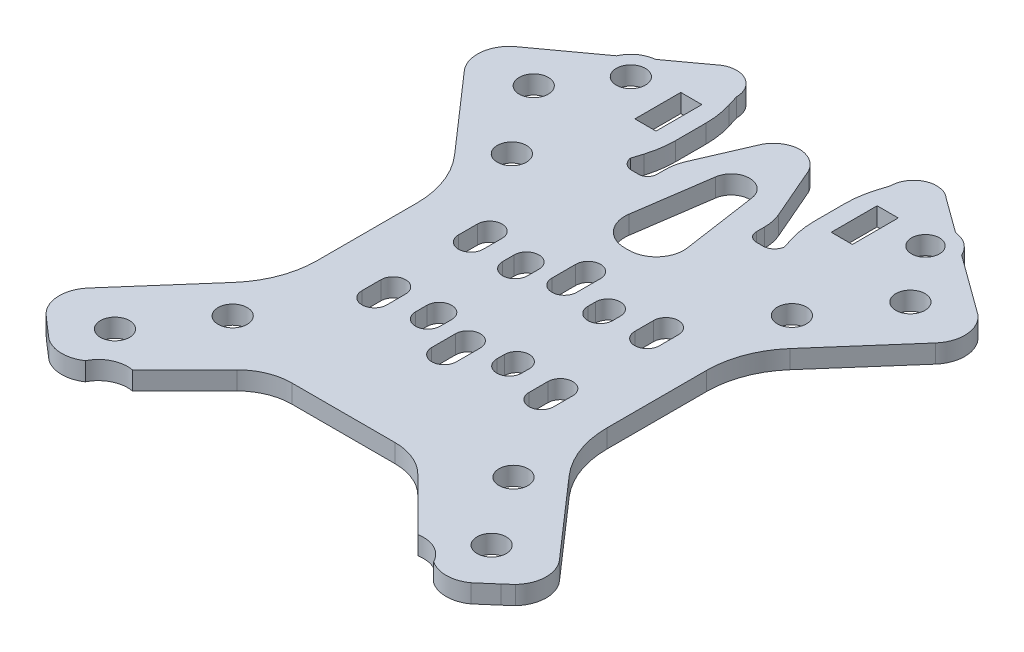
from build123d import *

# Parameters (mm, degrees)
CROQUIS2_R              = 1.59
CROQUIS2_R_2            = 1.5875
CROQUIS2_R_3            = 1.590000003
CROQUIS2_R_4            = 1.52
CROQUIS2_W              = 2.3
CROQUIS2_H              = 5
SALIENTE_EXTRUIR1_DEPTH = 2


with BuildPart() as part:
    # Croquis2 → Saliente-Extruir1 (new body)
    with BuildSketch(Plane(origin=(0, 0, 0), x_dir=(1, 0, 0), z_dir=(0, 1, 0))):
        with BuildLine():
            Line((-18.25536195, -12.016111847), (-25.654088229, -20.470893156))
            ThreePointArc((-25.654088229, -20.470893156), (-26.519678095, -22.835784768), (-25.57354606, -25.169621165))
            Line((-25.57354606, -25.169621165), (-24.742372568, -25.914075676))
            Line((-24.742372568, -25.914075676), (-22.972153409, -27.446083615))
            ThreePointArc((-22.972153409, -27.446083615), (-20.975135837, -28.097582379), (-18.96479715, -27.488428717))
            ThreePointArc((-18.96479715, -27.488428717), (-17.537304596, -26.067045976), (-15.541615973, -25.792654271))
            Line((-15.541615973, -25.792654271), (-9.856067815, -20.097418653))
            ThreePointArc((-9.856067815, -20.097418653), (-7.911909666, -18.801779306), (-5.620288821, -18.346909954))
            Line((-5.620288821, -18.346909954), (5.620288821, -18.346909954))
            ThreePointArc((5.620288821, -18.346909954), (7.911909666, -18.801779306), (9.856067815, -20.097418653))
            Line((9.856067815, -20.097418653), (15.541615973, -25.792654271))
            ThreePointArc((15.541615973, -25.792654271), (17.537304596, -26.067045976), (18.96479715, -27.488428717))
            ThreePointArc((18.96479715, -27.488428717), (20.975135837, -28.097582379), (22.972153409, -27.446083615))
            Line((22.972153409, -27.446083615), (24.742372568, -25.914075676))
            Line((24.742372568, -25.914075676), (25.57354606, -25.169621165))
            ThreePointArc((25.57354606, -25.169621165), (26.519678095, -22.835784768), (25.654088229, -20.470893156))
            Line((25.654088229, -20.470893156), (18.25536195, -12.016111847))
            ThreePointArc((18.25536195, -12.016111847), (16.419845193, -8.948181441), (15.780779256, -5.4306662))
            Line((15.780779256, -5.4306662), (15.780779256, 5.4306662))
            ThreePointArc((15.780779256, 5.4306662), (16.419845193, 8.948181441), (18.25536195, 12.016111847))
            Line((18.25536195, 12.016111847), (25.654088229, 20.470893156))
            ThreePointArc((25.654088229, 20.470893156), (26.530308227, 23.005689388), (25.355142951, 25.416485937))
            Line((25.355142951, 25.416485937), (18.78888202, 30.200247321))
            ThreePointArc((18.78888202, 30.200247321), (17.806953387, 31.422484528), (16.34255947, 31.982482822))
            Line((16.34255947, 31.982482822), (12.561458087, 34.737153551))
            ThreePointArc((12.561458087, 34.737153551), (9.874030074, 35.155779391), (8.394864944, 32.873327323))
            Line((8.394864944, 32.873327323), (8.021421807, 31.657286053))
            ThreePointArc((8.021421807, 31.657286053), (7.691575606, 30.205895283), (7.580808922, 28.721622928))
            Line((7.580808922, 28.721622928), (7.580808922, 25.398403441))
            ThreePointArc((7.580808922, 25.398403441), (7.695379905, 23.889001856), (8.036467551, 22.414186995))
            Line((8.036467551, 22.414186995), (8.38479276, 21.300147594))
            ThreePointArc((8.38479276, 21.300147594), (7.968360691, 20.527060023), (7.14619906, 20.218627998))
            Line((7.14619906, 20.218627998), (6.412176591, 20.218627998))
            ThreePointArc((6.412176591, 20.218627998), (5.70506981, 20.511521217), (5.412176591, 21.218627998))
            Line((5.412176591, 21.218627998), (5.412176591, 22.079422133))
            ThreePointArc((5.412176591, 22.079422133), (5.308230514, 23.093648922), (5.000714199, 24.065705754))
            Line((5.000714199, 24.065705754), (2.518171143, 29.800658234))
            ThreePointArc((2.518171143, 29.800658234), (1.464464231, 30.91120601), (0, 31.357254366))
            ThreePointArc((0, 31.357254366), (-1.464464231, 30.91120601), (-2.518171143, 29.800658234))
            Line((-2.518171143, 29.800658234), (-5.000714199, 24.065705754))
            ThreePointArc((-5.000714199, 24.065705754), (-5.308230514, 23.093648922), (-5.412176591, 22.079422133))
            Line((-5.412176591, 22.079422133), (-5.412176591, 21.218627998))
            ThreePointArc((-5.412176591, 21.218627998), (-5.70506981, 20.511521217), (-6.412176591, 20.218627998))
            Line((-6.412176591, 20.218627998), (-7.14619906, 20.218627998))
            ThreePointArc((-7.14619906, 20.218627998), (-7.968360691, 20.527060023), (-8.38479276, 21.300147594))
            Line((-8.38479276, 21.300147594), (-8.036467551, 22.414186995))
            ThreePointArc((-8.036467551, 22.414186995), (-7.695379905, 23.889001856), (-7.580808922, 25.398403441))
            Line((-7.580808922, 25.398403441), (-7.580808922, 28.721622928))
            ThreePointArc((-7.580808922, 28.721622928), (-7.691575606, 30.205895283), (-8.021421807, 31.657286053))
            Line((-8.021421807, 31.657286053), (-8.394864944, 32.873327323))
            ThreePointArc((-8.394864944, 32.873327323), (-9.874030074, 35.155779391), (-12.561458087, 34.737153551))
            Line((-12.561458087, 34.737153551), (-16.34255947, 31.982482822))
            ThreePointArc((-16.34255947, 31.982482822), (-17.806953387, 31.422484528), (-18.78888202, 30.200247321))
            Line((-18.78888202, 30.200247321), (-25.355142951, 25.416485937))
            ThreePointArc((-25.355142951, 25.416485937), (-26.530308227, 23.005689388), (-25.654088229, 20.470893156))
            Line((-25.654088229, 20.470893156), (-18.25536195, 12.016111847))
            ThreePointArc((-18.25536195, 12.016111847), (-16.419845193, 8.948181441), (-15.780779256, 5.4306662))
            Line((-15.780779256, 5.4306662), (-15.780779256, -5.4306662))
            ThreePointArc((-15.780779256, -5.4306662), (-16.419845193, -8.948181441), (-18.25536195, -12.016111847))
        make_face()
        with Locations(Location((-15.25, 15.25, 0), (0, 0, 270))):
            Circle(CROQUIS2_R, mode=Mode.SUBTRACT)
        with Locations(Location((-20.475551104, 22.857961383, 0), (0, 0, 270))):
            Circle(CROQUIS2_R_2, mode=Mode.SUBTRACT)
        with Locations(Location((-16.040434505, 28.997734842, 0), (0, 0, 270))):
            Circle(CROQUIS2_R_2, mode=Mode.SUBTRACT)
        with Locations(Location((15.25, 15.25, 0), (0, 0, 270))):
            Circle(CROQUIS2_R, mode=Mode.SUBTRACT)
        with Locations(Location((20.565117485, -22.768131206, 0), (0, 0, 270))):
            Circle(CROQUIS2_R_2, mode=Mode.SUBTRACT)
        with Locations(Location((-20.341013705, -22.888433679, 0), (0, 0, 270))):
            Circle(CROQUIS2_R_2, mode=Mode.SUBTRACT)
        with Locations(Location((-15.160301721, -15.249868102, 0), (0, 0, 270))):
            Circle(CROQUIS2_R_3, mode=Mode.SUBTRACT)
        with Locations(Location((15.339566381, -15.160169822, 0), (0, 0, 270))):
            Circle(CROQUIS2_R_2, mode=Mode.SUBTRACT)
        with Locations(Location((20.430580086, 22.978263857, 0), (0, 0, 270))):
            Circle(CROQUIS2_R_2, mode=Mode.SUBTRACT)
        with Locations(Location((15.959427109, 29.091844512, 0), (0, 0, 270))):
            Circle(CROQUIS2_R_4, mode=Mode.SUBTRACT)
        with BuildLine():
            Line((-1.35, 8.308113143), (-1.35, 5.718277528))
            ThreePointArc((-1.35, 5.718277528), (0, 4.368277528), (1.35, 5.718277528))
            Line((1.35, 5.718277528), (1.35, 8.308113143))
            ThreePointArc((1.35, 8.308113143), (0, 9.658113143), (-1.35, 8.308113143))
        make_face(mode=Mode.SUBTRACT)
        with BuildLine():
            Line((-7.808878773, -5.814643086), (-7.808878773, -3.761226184))
            ThreePointArc((-7.808878773, -3.761226184), (-9.158878773, -2.411226184), (-10.508878773, -3.761226184))
            Line((-10.508878773, -3.761226184), (-10.508878773, -5.814643086))
            ThreePointArc((-10.508878773, -5.814643086), (-9.158878773, -7.164643086), (-7.808878773, -5.814643086))
        make_face(mode=Mode.SUBTRACT)
        with BuildLine():
            Line((-2.890898672, -4.911820136), (-2.890898672, -3.666330657))
            ThreePointArc((-2.890898672, -3.666330657), (-4.240898672, -2.316330657), (-5.590898672, -3.666330657))
            Line((-5.590898672, -3.666330657), (-5.590898672, -4.911820136))
            ThreePointArc((-5.590898672, -4.911820136), (-4.240898672, -6.261820136), (-2.890898672, -4.911820136))
        make_face(mode=Mode.SUBTRACT)
        with BuildLine():
            Line((8.19090575, -6.317028248), (8.19090575, -4.263611346))
            ThreePointArc((8.19090575, -4.263611346), (9.54090575, -2.913611346), (10.89090575, -4.263611346))
            Line((10.89090575, -4.263611346), (10.89090575, -6.317028248))
            ThreePointArc((10.89090575, -6.317028248), (9.54090575, -7.667028248), (8.19090575, -6.317028248))
        make_face(mode=Mode.SUBTRACT)
        with BuildLine():
            Line((3.27292565, -4.911820136), (3.27292565, -4.074486775))
            ThreePointArc((3.27292565, -4.074486775), (4.62292565, -2.724486775), (5.97292565, -4.074486775))
            Line((5.97292565, -4.074486775), (5.97292565, -4.911820136))
            ThreePointArc((5.97292565, -4.911820136), (4.62292565, -6.261820136), (3.27292565, -4.911820136))
        make_face(mode=Mode.SUBTRACT)
        with Locations((-10.694064619, 27.741630955)):
            Rectangle(CROQUIS2_W, CROQUIS2_H, mode=Mode.SUBTRACT)
        with BuildLine():
            Line((-1.35, -7.377770249), (-1.35, -4.787934635))
            ThreePointArc((-1.35, -4.787934635), (0, -3.437934635), (1.35, -4.787934635))
            Line((1.35, -4.787934635), (1.35, -7.377770249))
            ThreePointArc((1.35, -7.377770249), (0, -8.727770249), (-1.35, -7.377770249))
        make_face(mode=Mode.SUBTRACT)
        with BuildLine():
            Line((0.235062276, 12.522369289), (-0.235062276, 12.522369289))
            ThreePointArc((-0.235062276, 12.522369289), (-2.488062555, 13.552617925), (-3.182517958, 15.930674736))
            Line((-3.182517958, 15.930674736), (-1.97907978, 24.185590314))
            ThreePointArc((-1.97907978, 24.185590314), (0, 25.897071292), (1.97907978, 24.185590314))
            Line((1.97907978, 24.185590314), (3.182517958, 15.930674736))
            ThreePointArc((3.182517958, 15.930674736), (2.488062555, 13.552617925), (0.235062276, 12.522369289))
        make_face(mode=Mode.SUBTRACT)
        with Locations((10.694064619, 27.741630955)):
            Rectangle(CROQUIS2_W, CROQUIS2_H, mode=Mode.SUBTRACT)
        with BuildLine():
            Line((3.27292565, 5.84216303), (3.27292565, 5.004829668))
            ThreePointArc((3.27292565, 5.004829668), (4.62292565, 3.654829668), (5.97292565, 5.004829668))
            Line((5.97292565, 5.004829668), (5.97292565, 5.84216303))
            ThreePointArc((5.97292565, 5.84216303), (4.62292565, 7.19216303), (3.27292565, 5.84216303))
        make_face(mode=Mode.SUBTRACT)
        with BuildLine():
            Line((8.19090575, 7.247371142), (8.19090575, 5.19395424))
            ThreePointArc((8.19090575, 5.19395424), (9.54090575, 3.84395424), (10.89090575, 5.19395424))
            Line((10.89090575, 5.19395424), (10.89090575, 7.247371142))
            ThreePointArc((10.89090575, 7.247371142), (9.54090575, 8.597371142), (8.19090575, 7.247371142))
        make_face(mode=Mode.SUBTRACT)
        with BuildLine():
            Line((-2.890898672, 5.84216303), (-2.890898672, 4.596673551))
            ThreePointArc((-2.890898672, 4.596673551), (-4.240898672, 3.246673551), (-5.590898672, 4.596673551))
            Line((-5.590898672, 4.596673551), (-5.590898672, 5.84216303))
            ThreePointArc((-5.590898672, 5.84216303), (-4.240898672, 7.19216303), (-2.890898672, 5.84216303))
        make_face(mode=Mode.SUBTRACT)
        with BuildLine():
            Line((-7.808878773, 6.744985979), (-7.808878773, 4.691569078))
            ThreePointArc((-7.808878773, 4.691569078), (-9.158878773, 3.341569078), (-10.508878773, 4.691569078))
            Line((-10.508878773, 4.691569078), (-10.508878773, 6.744985979))
            ThreePointArc((-10.508878773, 6.744985979), (-9.158878773, 8.094985979), (-7.808878773, 6.744985979))
        make_face(mode=Mode.SUBTRACT)
    extrude(amount=SALIENTE_EXTRUIR1_DEPTH)


solid = part.part
